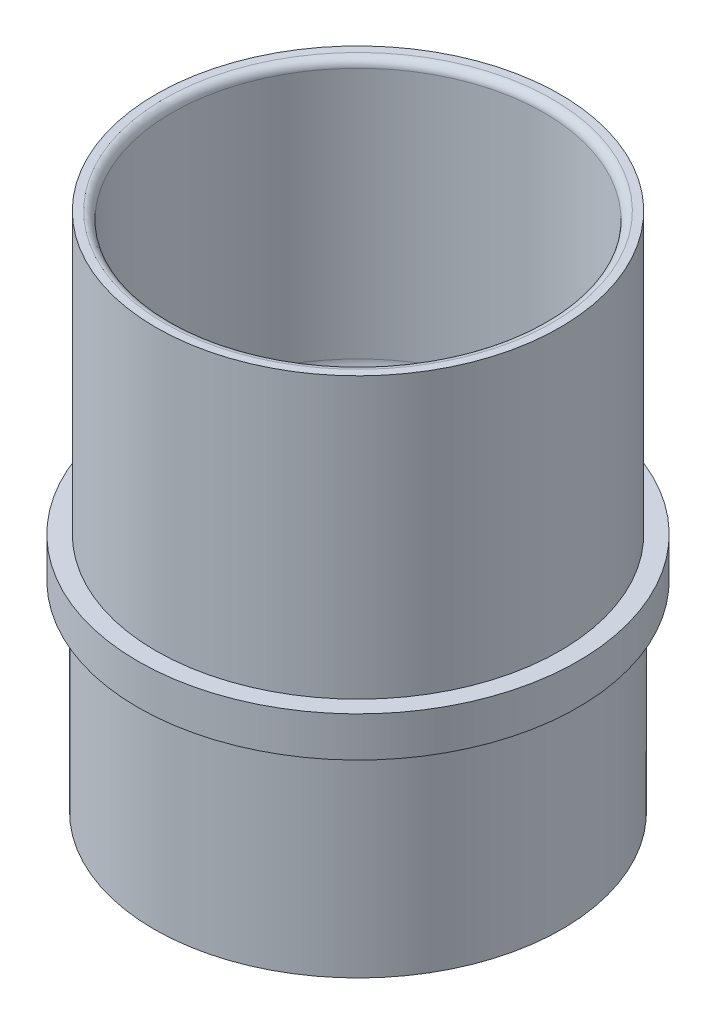
from build123d import *

# Parameters (mm, degrees)
SKETCH1_R           = 25.5
SKETCH1_R_2         = 23.5
BOSS_EXTRUDE1_DEPTH = 25
SKETCH2_R           = 27.5
BOSS_EXTRUDE2_DEPTH = 5
SKETCH3_R           = 25.25
SKETCH3_R_2         = 23.25
BOSS_EXTRUDE3_DEPTH = 35
FILLET1_R           = 2.54
FILLET2_R           = 1


with BuildPart() as part:
    # Sketch1 → Boss-Extrude1 (new body)
    with BuildSketch(Plane(origin=(0, 0, 0), x_dir=(1, 0, 0), z_dir=(0, 1, 0))):
        with Locations(Location((0, 0, 0), (0, 0, 270))):
            Circle(SKETCH1_R)
        with Locations(Location((0, 0, 0), (0, 0, 270))):
            Circle(SKETCH1_R_2, mode=Mode.SUBTRACT)
    extrude(amount=BOSS_EXTRUDE1_DEPTH)

    # Sketch2 → Boss-Extrude2 (add)
    with BuildSketch(Plane(origin=(0, 25, 0), x_dir=(1, 0, 0), z_dir=(0, 1, 0))):
        with Locations(Location((0, 0, 0), (0, 0, 270))):
            Circle(SKETCH2_R)
    extrude(amount=BOSS_EXTRUDE2_DEPTH)

    # Sketch3 → Boss-Extrude3 (add)
    with BuildSketch(Plane(origin=(0, 30, 0), x_dir=(1, 0, 0), z_dir=(0, 1, 0))):
        with Locations(Location((0, 0, 0), (0, 0, 270))):
            Circle(SKETCH3_R)
        with Locations(Location((0, 0, 0), (0, 0, 270))):
            Circle(SKETCH3_R_2, mode=Mode.SUBTRACT)
    extrude(amount=BOSS_EXTRUDE3_DEPTH)

    # Fillet1
    fillet1_edges = [part.edges().sort_by_distance(p)[0] for p in [
        (0, 30, -23.25),
    ]]
    fillet(fillet1_edges, radius=FILLET1_R)

    # Fillet2
    fillet2_edges = [part.edges().sort_by_distance(p)[0] for p in [
        (0, 65, -23.25),
    ]]
    fillet(fillet2_edges, radius=FILLET2_R)


solid = part.part
